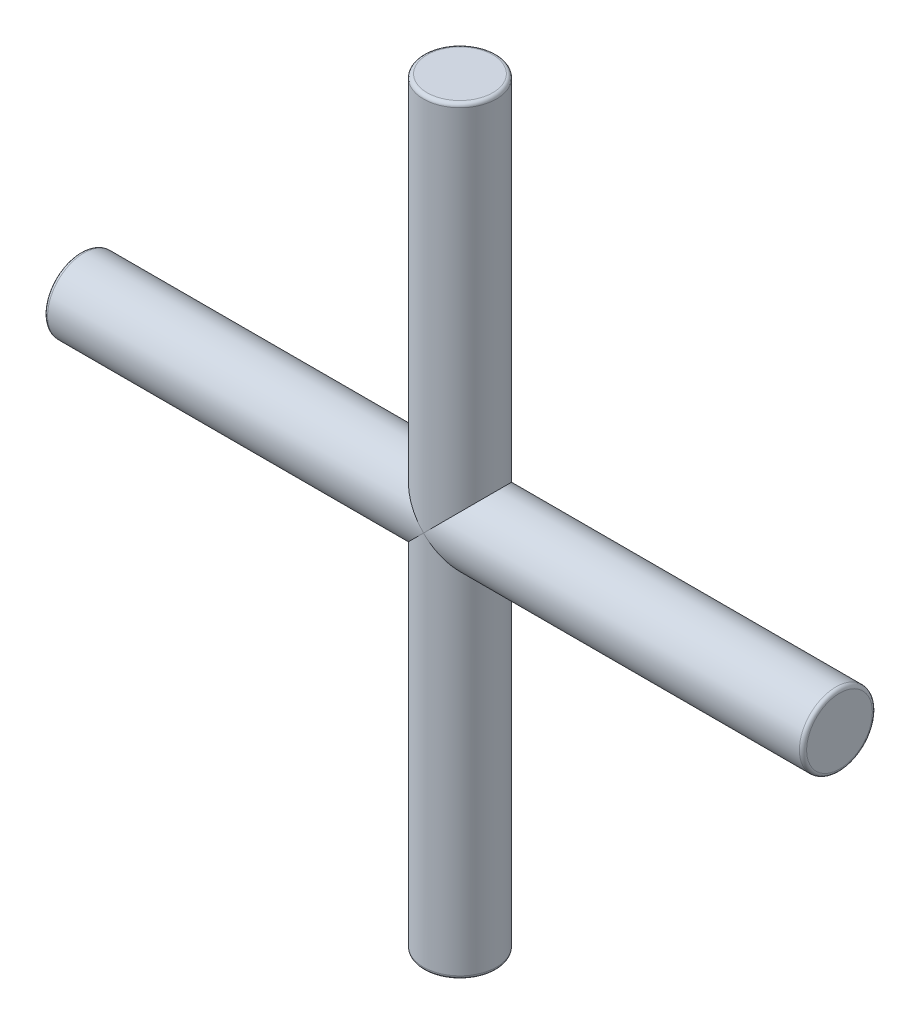
from build123d import *

# Parameters (mm, degrees)
SKETCH1_R           = 2500
BOSS_EXTRUDE1_DEPTH = 26000
SKETCH3_R           = 2500
BOSS_EXTRUDE2_DEPTH = 26000
FILLET1_R           = 250


with BuildPart() as part:
    # Sketch1 → Boss-Extrude1 (new, symmetric)
    with BuildSketch(Plane(origin=(0, 0, 0), x_dir=(0, 0, -1), z_dir=(1, 0, 0))):
        Circle(SKETCH1_R)
    extrude(amount=BOSS_EXTRUDE1_DEPTH, both=True)

    # Sketch3 → Boss-Extrude2 (add, symmetric)
    with BuildSketch(Plane(origin=(0, 0, 0), x_dir=(1, 0, 0), z_dir=(0, 1, 0))):
        with Locations(Location((0, 0, 0), (0, 0, 270))):
            Circle(SKETCH3_R)
    extrude(amount=BOSS_EXTRUDE2_DEPTH, both=True)

    # Fillet1
    fillet1_edges = [part.edges().sort_by_distance(p)[0] for p in [
        (-26000, 0, 2500),
        (26000, 0, 2500),
        (0, -26000, -2500),
        (0, 26000, -2500),
    ]]
    fillet(fillet1_edges, radius=FILLET1_R)


solid = part.part
